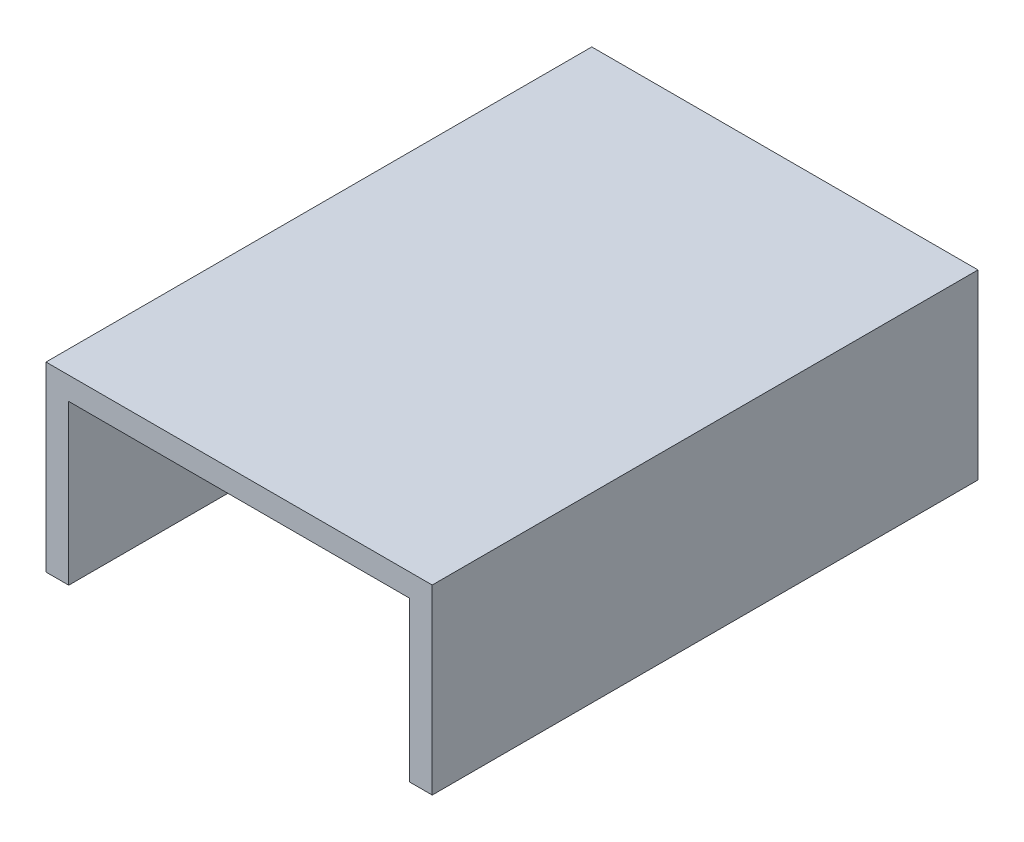
from build123d import *

# Parameters (mm, degrees)
BOSS_EXTRUDE1_DEPTH = 76.2


with BuildPart() as part:
    # Sketch1 → Boss-Extrude1 (new body)
    with BuildSketch(Plane.XY):
        Polygon((-26.9621, -22.225), (-26.9621, 3.175), (26.9621, 3.175), (26.9621, -22.225), (23.7871, -22.225), (23.7871, 0), (-23.7871, 0), (-23.7871, -22.225), align=None)
    extrude(amount=BOSS_EXTRUDE1_DEPTH)


solid = part.part
